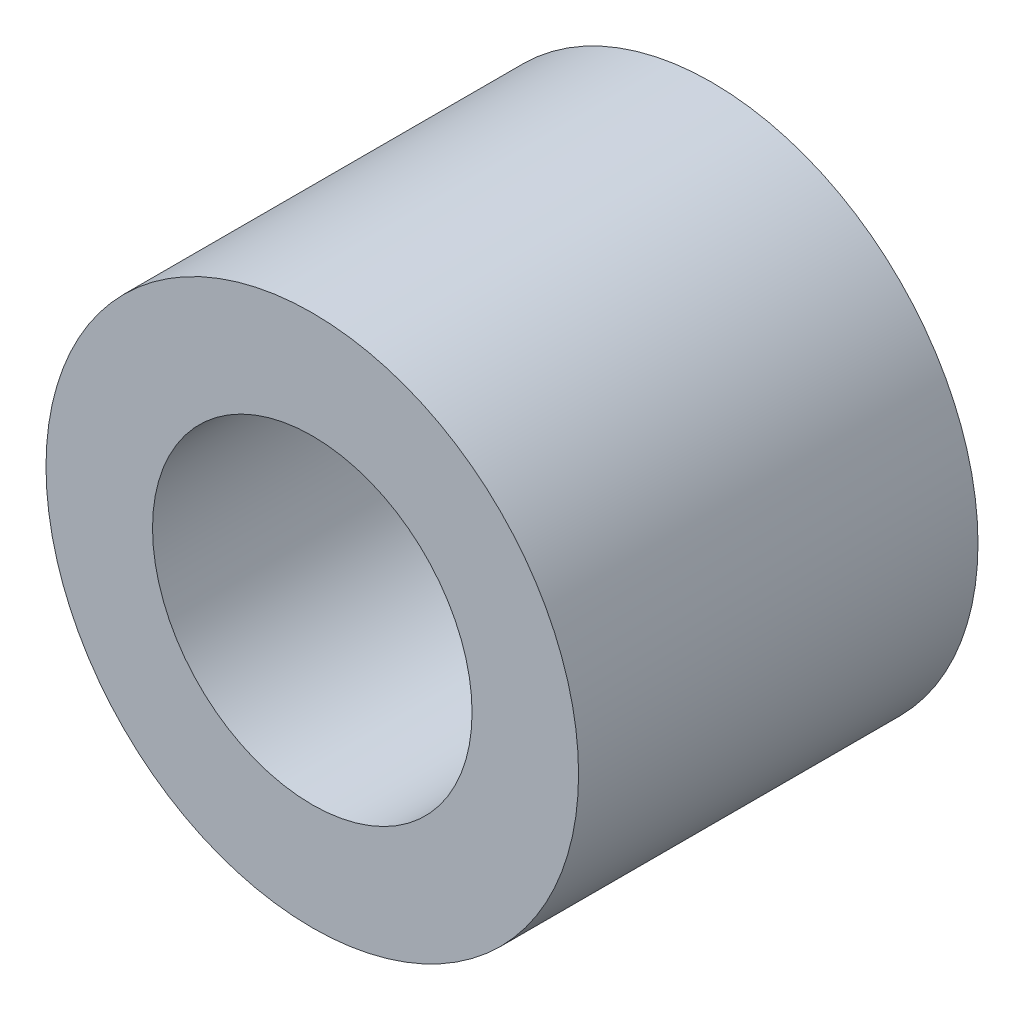
from build123d import *

# Parameters (mm, degrees)
CROQUIS1_R              = 2
CROQUIS1_R_2            = 1.2
SALIENTE_EXTRUIR1_DEPTH = 3


with BuildPart() as part:
    # Croquis1 → Saliente-Extruir1 (new body)
    with BuildSketch(Plane.XY):
        Circle(CROQUIS1_R)
        Circle(CROQUIS1_R_2, mode=Mode.SUBTRACT)
    extrude(amount=SALIENTE_EXTRUIR1_DEPTH)


solid = part.part
